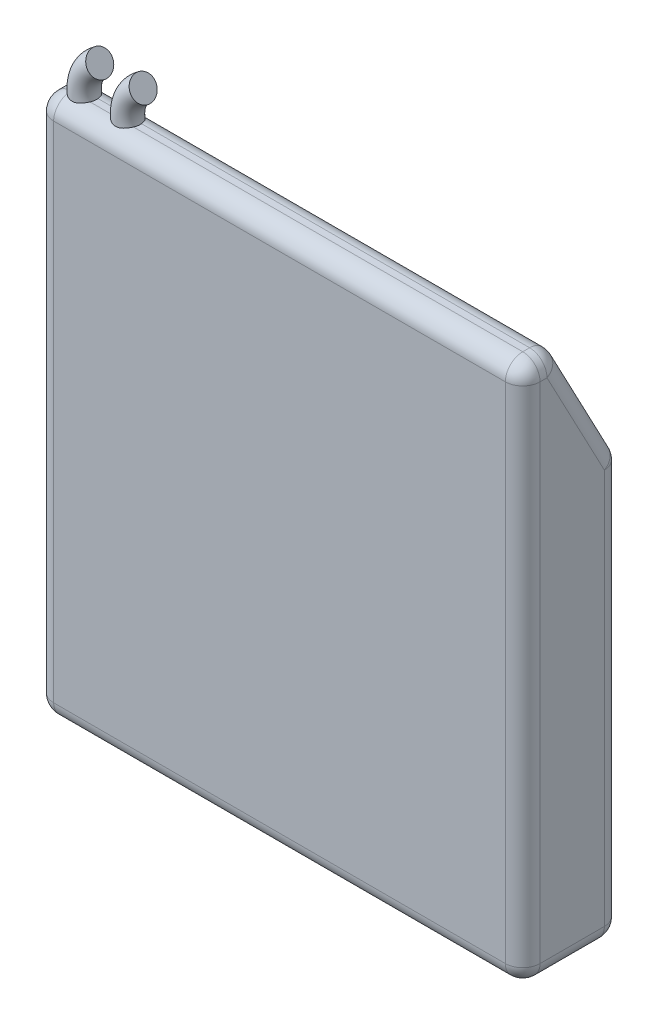
from build123d import *

# Parameters (mm, degrees)
BOSS_EXTRUDE1_DEPTH = 28
FILLET1_R           = 1
SWEEP1_PROFILE_R    = 0.7
LPATTERN1_COUNT     = 2
LPATTERN1_PITCH     = 2.5


with BuildPart() as part:
    # Sketch1 → Boss-Extrude1 (new body)
    with BuildSketch(Plane(origin=(0, 0, 0), x_dir=(0, 0, -1), z_dir=(1, 0, 0))):
        Polygon((0, 0), (0, 31), (2, 31), (5.7, 24), (5.7, 0), align=None)
    extrude(amount=BOSS_EXTRUDE1_DEPTH)

    # Fillet1
    fillet1_edges = [part.edges().sort_by_distance(p)[0] for p in [
        (28, 15.5, 0),
        (28, 31, -1),
        (28, 27.5, -3.85),
        (28, 12, -5.7),
        (0, 27.5, -3.85),
        (0, 31, -1),
        (0, 15.5, 0),
        (0, 0, -2.85),
        (0, 12, -5.7),
        (28, 0, -2.85),
        (14, 24, -5.7),
        (14, 31, -2),
        (14, 31, 0),
        (14, 0, 0),
        (14, 0, -5.7),
    ]]
    fillet(fillet1_edges, radius=FILLET1_R)

    # Sweep1: sweep along a path in Sketch2
    with BuildLine(Plane.XY.offset(-1.3)) as sweep1_path:
        ThreePointArc((2.353185581, 32.918653967), (1.45227767, 31.219358637), (2.297855958, 29.491864196))
    # Sweep1 profile (on start of the path) → Sweep1 (sweep)
    with BuildSketch(Plane(origin=(2.353185581, 32.918653967, -1.3), x_dir=(0.5744773116902536, -0.8185205057621582, 0), z_dir=(-0.8185205057621582, -0.5744773116902536, 0))):
        Circle(SWEEP1_PROFILE_R)
    sweep1 = sweep(path=sweep1_path.line)

    # LPattern1: Sweep1 ×2
    with Locations(*[(i * LPATTERN1_PITCH, 0, 0) for i in range(1, LPATTERN1_COUNT)]):
        add(sweep1)


solid = part.part
